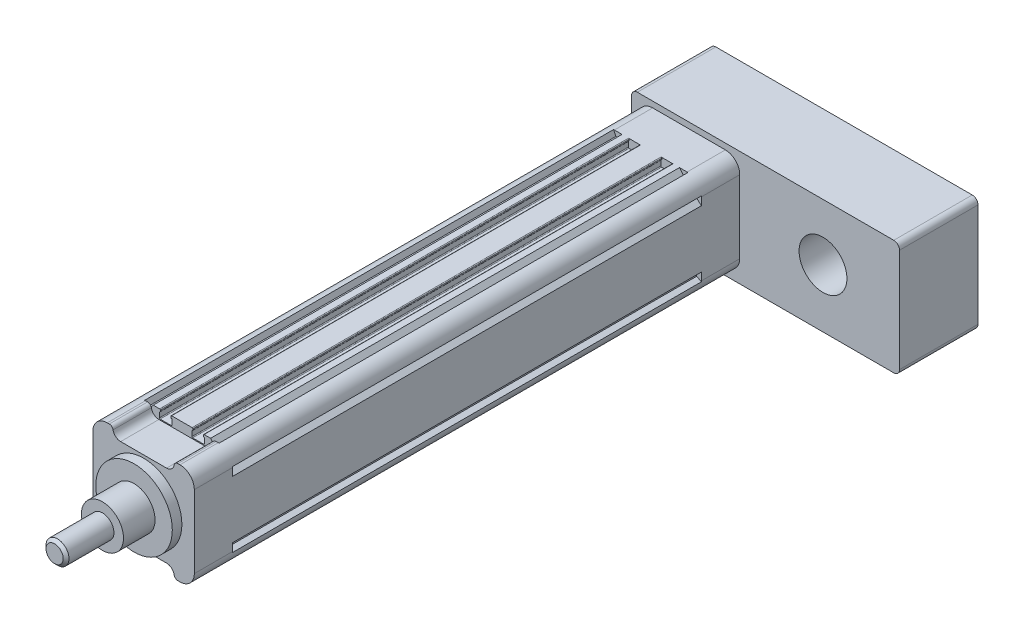
from build123d import *

# Parameters (mm, degrees)
SKETCH_1_R                  = 2.1
EXTRUDE_1_DEPTH             = 245
EXTRUDE_2_DEPTH             = 20
SKETCH_7_R                  = 20
EXTRUDE_3_DEPTH             = 5
SKETCH_9_R                  = 11
EXTRUDE_4_DEPTH             = 16.5
SKETCH_10_R                 = 6
EXTRUDE_5_DEPTH             = 25
EXTRUDE_START               = 20
EXTRUDE_6_DEPTH             = 20
EXTRUDE_7_DEPTH             = 41
SKETCH_13_R                 = 12.5
CUT_EXTRUDE_2_DEPTH         = 30
PATTERN_LINEAR_1_COUNT      = 2
PATTERN_LINEAR_1_PITCH      = 38
PATTERN_LINEAR_1_COUNT_DIR2 = 2
PATTERN_LINEAR_1_PITCH_DIR2 = 38
HOLE_WIZARD_M6_2_D          = 5
HOLE_WIZARD_M6_2_DEPTH      = 15
HOLE_WIZARD_M6_2_TIP        = 1.502151548
HOLE_WIZARD_M6_3_D          = 5
HOLE_WIZARD_M6_3_DEPTH      = 15
HOLE_WIZARD_M6_3_TIP        = 1.502151548
HOLE_WIZARD_M6_4_D          = 5
HOLE_WIZARD_M6_4_DEPTH      = 15
HOLE_WIZARD_M6_4_TIP        = 1.502151548
CHAMFER_1_SIZE              = 1.5


with BuildPart() as part:
    # 草图1 → 凸台-拉伸1 (new body)
    with BuildSketch(Plane.XY):
        with BuildLine():
            Line((-18.2, 24), (-19.443439638, 26.486879276))
            ThreePointArc((-19.443439638, 26.486879276), (-24.303300859, 24.303300859), (-26.486879276, 19.443439638))
            Line((-26.486879276, 19.443439638), (-24, 18.2))
            Line((-24, 18.2), (-24, 17.1))
            Line((-24, 17.1), (-26.5, 15))
            Line((-26.5, 15), (-26.5, -15))
            Line((-26.5, -15), (-24, -17.1))
            Line((-24, -17.1), (-24, -18.2))
            Line((-24, -18.2), (-26.486879276, -19.443439638))
            ThreePointArc((-26.486879276, -19.443439638), (-24.303300859, -24.303300859), (-19.443439638, -26.486879276))
            Line((-19.443439638, -26.486879276), (-18.2, -24))
            Line((-18.2, -24), (-17.1, -24))
            Line((-17.1, -24), (-15, -26.5))
            Line((-15, -26.5), (-11.65, -26.5))
            ThreePointArc((-11.65, -26.5), (-11.367157288, -26.382842712), (-11.25, -26.1))
            Line((-11.25, -26.1), (-11.25, -25.6))
            ThreePointArc((-11.25, -25.6), (-11.367157288, -25.317157288), (-11.65, -25.2))
            Line((-11.65, -25.2), (-11.75, -25.2))
            Line((-11.75, -25.2), (-11.75, -22.4))
            ThreePointArc((-11.75, -22.4), (-11.632842712, -22.117157288), (-11.35, -22))
            Line((-11.35, -22), (-5.65, -22))
            ThreePointArc((-5.65, -22), (-5.367157288, -22.117157288), (-5.25, -22.4))
            Line((-5.25, -22.4), (-5.25, -25.2))
            Line((-5.25, -25.2), (-5.35, -25.2))
            ThreePointArc((-5.35, -25.2), (-5.632842712, -25.317157288), (-5.75, -25.6))
            Line((-5.75, -25.6), (-5.75, -26.1))
            ThreePointArc((-5.75, -26.1), (-5.632842712, -26.382842712), (-5.35, -26.5))
            Line((-5.35, -26.5), (5.35, -26.5))
            ThreePointArc((5.35, -26.5), (5.632842712, -26.382842712), (5.75, -26.1))
            Line((5.75, -26.1), (5.75, -25.6))
            ThreePointArc((5.75, -25.6), (5.632842712, -25.317157288), (5.35, -25.2))
            Line((5.35, -25.2), (5.25, -25.2))
            Line((5.25, -25.2), (5.25, -22.4))
            ThreePointArc((5.25, -22.4), (5.367157288, -22.117157288), (5.65, -22))
            Line((5.65, -22), (11.35, -22))
            ThreePointArc((11.35, -22), (11.632842712, -22.117157288), (11.75, -22.4))
            Line((11.75, -22.4), (11.75, -25.2))
            Line((11.75, -25.2), (11.65, -25.2))
            ThreePointArc((11.65, -25.2), (11.367157288, -25.317157288), (11.25, -25.6))
            Line((11.25, -25.6), (11.25, -26.1))
            ThreePointArc((11.25, -26.1), (11.367157288, -26.382842712), (11.65, -26.5))
            Line((11.65, -26.5), (15, -26.5))
            Line((15, -26.5), (17.1, -24))
            Line((17.1, -24), (18.2, -24))
            Line((18.2, -24), (19.443439638, -26.486879276))
            ThreePointArc((19.443439638, -26.486879276), (24.303300859, -24.303300859), (26.486879276, -19.443439638))
            Line((26.486879276, -19.443439638), (24, -18.2))
            Line((24, -18.2), (24, -17.1))
            Line((24, -17.1), (26.5, -15))
            Line((26.5, -15), (26.5, 15))
            Line((26.5, 15), (24, 17.1))
            Line((24, 17.1), (24, 18.2))
            Line((24, 18.2), (26.486879276, 19.443439638))
            ThreePointArc((26.486879276, 19.443439638), (24.303300859, 24.303300859), (19.443439638, 26.486879276))
            Line((19.443439638, 26.486879276), (18.2, 24))
            Line((18.2, 24), (17.1, 24))
            Line((17.1, 24), (15, 26.5))
            Line((15, 26.5), (11.65, 26.5))
            ThreePointArc((11.65, 26.5), (11.367157288, 26.382842712), (11.25, 26.1))
            Line((11.25, 26.1), (11.25, 25.6))
            ThreePointArc((11.25, 25.6), (11.367157288, 25.317157288), (11.65, 25.2))
            Line((11.65, 25.2), (11.75, 25.2))
            Line((11.75, 25.2), (11.75, 22.4))
            ThreePointArc((11.75, 22.4), (11.632842712, 22.117157288), (11.35, 22))
            Line((11.35, 22), (5.65, 22))
            ThreePointArc((5.65, 22), (5.367157288, 22.117157288), (5.25, 22.4))
            Line((5.25, 22.4), (5.25, 25.2))
            Line((5.25, 25.2), (5.35, 25.2))
            ThreePointArc((5.35, 25.2), (5.632842712, 25.317157288), (5.75, 25.6))
            Line((5.75, 25.6), (5.75, 26.1))
            ThreePointArc((5.75, 26.1), (5.632842712, 26.382842712), (5.35, 26.5))
            Line((5.35, 26.5), (-5.35, 26.5))
            ThreePointArc((-5.35, 26.5), (-5.632842712, 26.382842712), (-5.75, 26.1))
            Line((-5.75, 26.1), (-5.75, 25.6))
            ThreePointArc((-5.75, 25.6), (-5.632842712, 25.317157288), (-5.35, 25.2))
            Line((-5.35, 25.2), (-5.25, 25.2))
            Line((-5.25, 25.2), (-5.25, 22.4))
            ThreePointArc((-5.25, 22.4), (-5.367157288, 22.117157288), (-5.65, 22))
            Line((-5.65, 22), (-11.35, 22))
            ThreePointArc((-11.35, 22), (-11.632842712, 22.117157288), (-11.75, 22.4))
            Line((-11.75, 22.4), (-11.75, 25.2))
            Line((-11.75, 25.2), (-11.65, 25.2))
            ThreePointArc((-11.65, 25.2), (-11.367157288, 25.317157288), (-11.25, 25.6))
            Line((-11.25, 25.6), (-11.25, 26.1))
            ThreePointArc((-11.25, 26.1), (-11.367157288, 26.382842712), (-11.65, 26.5))
            Line((-11.65, 26.5), (-15, 26.5))
            Line((-15, 26.5), (-17.1, 24))
            Line((-17.1, 24), (-18.2, 24))
        make_face()
        with Locations((19, 19)):
            Circle(SKETCH_1_R, mode=Mode.SUBTRACT)
        with Locations((19, -19)):
            Circle(SKETCH_1_R, mode=Mode.SUBTRACT)
        with Locations((-19, -19)):
            Circle(SKETCH_1_R, mode=Mode.SUBTRACT)
        with Locations((-19, 19)):
            Circle(SKETCH_1_R, mode=Mode.SUBTRACT)
        with BuildLine():
            Line((19.773719933, 3), (23.3, 3))
            Line((23.3, 3), (23.3, -3))
            Line((23.3, -3), (19.773719933, -3))
            ThreePointArc((19.773719933, -3), (0, -20), (-19.773719933, -3))
            Line((-19.773719933, -3), (-23.3, -3))
            Line((-23.3, -3), (-23.3, 3))
            Line((-23.3, 3), (-19.773719933, 3))
            ThreePointArc((-19.773719933, 3), (0, 20), (19.773719933, 3))
        make_face(mode=Mode.SUBTRACT)
    extrude(amount=EXTRUDE_1_DEPTH)

    # 草图6 → 凸台-拉伸2 (add)
    with BuildSketch(Plane.XY.offset(245)):
        with BuildLine():
            Line((-26.5, -19), (-26.5, 19))
            ThreePointArc((-26.5, 19), (-24.303300859, 24.303300859), (-19, 26.5))
            Line((-19, 26.5), (-17.916079783, 26.5))
            ThreePointArc((-17.916079783, 26.5), (-16.625085334, 26.027525232), (-15.944053189, 24.833333333))
            ThreePointArc((-15.944053189, 24.833333333), (-14.581988897, 22.444949537), (-12, 21.5))
            Line((-12, 21.5), (12, 21.5))
            ThreePointArc((12, 21.5), (14.581988897, 22.444949537), (15.944053189, 24.833333333))
            ThreePointArc((15.944053189, 24.833333333), (16.625085334, 26.027525232), (17.916079783, 26.5))
            Line((17.916079783, 26.5), (19, 26.5))
            ThreePointArc((19, 26.5), (24.303300859, 24.303300859), (26.5, 19))
            Line((26.5, 19), (26.5, -19))
            ThreePointArc((26.5, -19), (24.303300859, -24.303300859), (19, -26.5))
            Line((19, -26.5), (17.916079783, -26.5))
            ThreePointArc((17.916079783, -26.5), (16.625085334, -26.027525232), (15.944053189, -24.833333333))
            ThreePointArc((15.944053189, -24.833333333), (14.581988897, -22.444949537), (12, -21.5))
            Line((12, -21.5), (-12, -21.5))
            ThreePointArc((-12, -21.5), (-14.581988897, -22.444949537), (-15.944053189, -24.833333333))
            ThreePointArc((-15.944053189, -24.833333333), (-16.625085334, -26.027525232), (-17.916079783, -26.5))
            Line((-17.916079783, -26.5), (-19, -26.5))
            ThreePointArc((-19, -26.5), (-24.303300859, -24.303300859), (-26.5, -19))
        make_face()
    extrude(amount=EXTRUDE_2_DEPTH)

    # 草图7 → 凸台-拉伸3 (add)
    with BuildSketch(Plane.XY.offset(265)):
        Circle(SKETCH_7_R)
    extrude(amount=EXTRUDE_3_DEPTH)

    # 草图9 → 凸台-拉伸4 (add)
    with BuildSketch(Plane.XY.offset(270)):
        Circle(SKETCH_9_R)
    extrude(amount=EXTRUDE_4_DEPTH)

    # 草图10 → 凸台-拉伸5 (add)
    with BuildSketch(Plane.XY.offset(286.5)):
        Circle(SKETCH_10_R)
    extrude(amount=EXTRUDE_5_DEPTH)

    # 草图11 → 凸台-拉伸6 (add)
    with BuildSketch(Plane(origin=(0, 0, 0), x_dir=(-1, 0, 0), z_dir=(0, 0, -1)).offset(EXTRUDE_START)):
        with BuildLine():
            Line((-19, -26.5), (19, -26.5))
            ThreePointArc((19, -26.5), (24.303300859, -24.303300859), (26.5, -19))
            Line((26.5, -19), (26.5, 19))
            ThreePointArc((26.5, 19), (24.303300859, 24.303300859), (19, 26.5))
            Line((19, 26.5), (-19, 26.5))
            ThreePointArc((-19, 26.5), (-24.303300859, 24.303300859), (-26.5, 19))
            Line((-26.5, 19), (-26.5, -19))
            ThreePointArc((-26.5, -19), (-24.303300859, -24.303300859), (-19, -26.5))
        make_face()
    extrude(amount=-EXTRUDE_6_DEPTH)

    # 草图12 → 凸台-拉伸7 (add)
    with BuildSketch(Plane(origin=(0, 0, -20), x_dir=(-1, 0, 0), z_dir=(0, 0, -1))):
        with BuildLine():
            Line((-107, -30.404162038), (27, -30.404162038))
            ThreePointArc((27, -30.404162038), (29.121320344, -29.525482382), (30, -27.404162038))
            Line((30, -27.404162038), (30, 26.595837962))
            ThreePointArc((30, 26.595837962), (29.121320344, 28.717158305), (27, 29.595837962))
            Line((27, 29.595837962), (-107, 29.595837962))
            ThreePointArc((-107, 29.595837962), (-109.121320344, 28.717158305), (-110, 26.595837962))
            Line((-110, 26.595837962), (-110, -27.404162038))
            ThreePointArc((-110, -27.404162038), (-109.121320344, -29.525482382), (-107, -30.404162038))
        make_face()
    extrude(amount=EXTRUDE_7_DEPTH)

    # 草图13 → 切除-拉伸2 (cut)
    with BuildSketch(Plane.XY.offset(-20)):
        with Locations((70, 0)):
            Circle(SKETCH_13_R)
    extrude(amount=-CUT_EXTRUDE_2_DEPTH, mode=Mode.SUBTRACT)

    # 草图15 → M6 螺纹孔1 (revolve, cut)
    with BuildSketch(Plane(origin=(-19, -19, -61), x_dir=(0, 1, 0), z_dir=(1, 0, 0))):
        Polygon((0, 0), (0, 16.502151548), (2.5, 15), (2.5, 0), align=None)
    hole_wizard_m6_1 = revolve(axis=Axis((-19, -19, -67.35), (0, 0, 1)), mode=Mode.SUBTRACT)

    # 阵列(线性)1: Hole Wizard M6 _1 2 × 2
    with Locations(*[(j * PATTERN_LINEAR_1_PITCH_DIR2, i * PATTERN_LINEAR_1_PITCH, 0) for i in range(PATTERN_LINEAR_1_COUNT) for j in range(PATTERN_LINEAR_1_COUNT_DIR2) if (i, j) != (0, 0)]):
        add(hole_wizard_m6_1, mode=Mode.SUBTRACT)

    # M6 螺纹孔2
    with Locations(Plane(origin=(0, 0, -61), x_dir=(-1, 0, 0), z_dir=(0, 0, -1))):
        with Locations((-84, -19), (-84, 19)):
            Hole(HOLE_WIZARD_M6_2_D / 2, depth=HOLE_WIZARD_M6_2_DEPTH)
            with Locations((0, 0, -(HOLE_WIZARD_M6_2_DEPTH + HOLE_WIZARD_M6_2_TIP / 2))):  # 118° drill point
                Cone(0, HOLE_WIZARD_M6_2_D / 2, HOLE_WIZARD_M6_2_TIP, mode=Mode.SUBTRACT)

    # M6 螺纹孔3
    with Locations(Plane.ZY.offset(26.5)):
        with Locations((255, 11), (255, -11)):
            Hole(HOLE_WIZARD_M6_3_D / 2, depth=HOLE_WIZARD_M6_3_DEPTH)
            with Locations((0, 0, -(HOLE_WIZARD_M6_3_DEPTH + HOLE_WIZARD_M6_3_TIP / 2))):  # 118° drill point
                Cone(0, HOLE_WIZARD_M6_3_D / 2, HOLE_WIZARD_M6_3_TIP, mode=Mode.SUBTRACT)

    # M6 螺纹孔4
    with Locations(Plane.ZY.offset(26.5)):
        with Locations((-10, 11), (-10, -11)):
            Hole(HOLE_WIZARD_M6_4_D / 2, depth=HOLE_WIZARD_M6_4_DEPTH)
            with Locations((0, 0, -(HOLE_WIZARD_M6_4_DEPTH + HOLE_WIZARD_M6_4_TIP / 2))):  # 118° drill point
                Cone(0, HOLE_WIZARD_M6_4_D / 2, HOLE_WIZARD_M6_4_TIP, mode=Mode.SUBTRACT)

    # 倒角1
    chamfer_1_edges = [part.edges().sort_by_distance(p)[0] for p in [
        (-6, 0, 311.5),
    ]]
    chamfer(chamfer_1_edges, length=CHAMFER_1_SIZE)


solid = part.part
